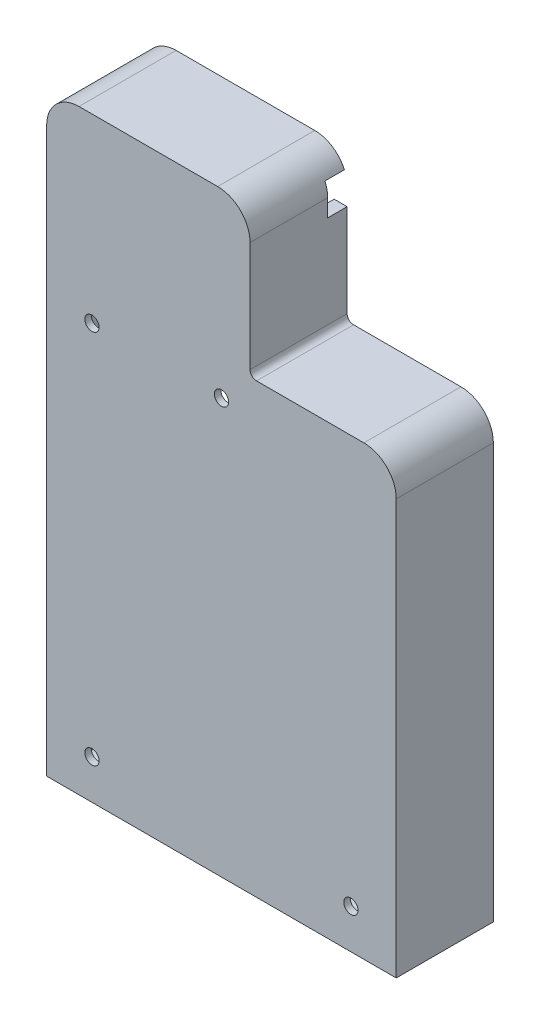
from build123d import *

# Parameters (mm, degrees)
BOSS_EXTRUDE1_DEPTH = 15
BOSS_EXTRUDE2_DEPTH = 15
CUT_EXTRUDE1_DEPTH  = 14
SKETCH8_W           = 6.699223296
SKETCH8_H           = 4.721357371
SKETCH8_W_2         = 8.228893272
CUT_EXTRUDE7_DEPTH  = 3
SKETCH10_R          = 1.1
CUT_EXTRUDE9_DEPTH  = 15


with BuildPart() as part:
    # Sketch3 → Boss-Extrude1 (new body)
    with BuildSketch(Plane.XY.offset(1303.472903018)):
        with BuildLine():
            Line((839.650097305, 1097.589789038), (839.650097371, 1033.49652121))
            Line((839.650097371, 1033.49652121), (785.650097371, 1033.49652121))
            Line((785.650097371, 1033.49652121), (785.650097438, 1120.589789038))
            ThreePointArc((785.650097438, 1120.589789038), (787.114883847, 1124.124637961), (790.64973277, 1125.58942437))
            Line((790.64973277, 1125.58942437), (812.066461973, 1125.58942437))
            ThreePointArc((812.066461973, 1125.58942437), (815.601310896, 1124.124637961), (817.066097305, 1120.589789038))
            Line((817.066097305, 1120.589789038), (817.066097305, 1103.589789038))
            ThreePointArc((817.066097305, 1103.589789038), (817.35931084, 1102.882637905), (818.066461973, 1102.58942437))
            Line((818.066461973, 1102.58942437), (834.650461973, 1102.58942437))
            ThreePointArc((834.650461973, 1102.58942437), (838.185310896, 1101.124637961), (839.650097305, 1097.589789038))
        make_face()
        with BuildLine():
            Line((787.650097371, 1035.49652121), (787.650097371, 1120.589424436))
            ThreePointArc((787.650097371, 1120.589424436), (788.529097371, 1122.710424436), (790.650097371, 1123.589424436))
            Line((790.650097371, 1123.589424436), (812.066097371, 1123.589424436))
            ThreePointArc((812.066097371, 1123.589424436), (814.187097371, 1122.710424436), (815.066097371, 1120.589424436))
            Line((815.066097371, 1120.589424436), (815.066097371, 1103.589424436))
            ThreePointArc((815.066097371, 1103.589424436), (815.945097371, 1101.468424436), (818.066097371, 1100.589424436))
            Line((818.066097371, 1100.589424436), (834.650097371, 1100.589424436))
            ThreePointArc((834.650097371, 1100.589424436), (836.771097371, 1099.710424436), (837.650097371, 1097.589424436))
            Line((837.650097371, 1097.589424436), (837.650097371, 1035.49652121))
            Line((837.650097371, 1035.49652121), (787.650097371, 1035.49652121))
        make_face(mode=Mode.SUBTRACT)
    extrude(amount=BOSS_EXTRUDE1_DEPTH)

    # Sketch6 → Boss-Extrude2 (add)
    with BuildSketch(Plane.XY.offset(1303.472903018)):
        with BuildLine():
            Line((787.650097371, 1035.49652121), (837.650097371, 1035.49652121))
            Line((837.650097371, 1035.49652121), (837.650097371, 1097.589424436))
            ThreePointArc((837.650097371, 1097.589424436), (836.771097371, 1099.710424436), (834.650097371, 1100.589424436))
            Line((834.650097371, 1100.589424436), (818.066097371, 1100.589424436))
            ThreePointArc((818.066097371, 1100.589424436), (815.945097371, 1101.468424436), (815.066097371, 1103.589424436))
            Line((815.066097371, 1103.589424436), (815.066097371, 1120.589424436))
            ThreePointArc((815.066097371, 1120.589424436), (814.187097371, 1122.710424436), (812.066097371, 1123.589424436))
            Line((812.066097371, 1123.589424436), (790.650097371, 1123.589424436))
            ThreePointArc((790.650097371, 1123.589424436), (788.529097371, 1122.710424436), (787.650097371, 1120.589424436))
            Line((787.650097371, 1120.589424436), (787.650097371, 1035.49652121))
        make_face()
    extrude(amount=BOSS_EXTRUDE2_DEPTH)

    # Sketch6<2> → Cut-Extrude1 (cut)
    with BuildSketch(Plane.XY.offset(1303.472903018)):
        with BuildLine():
            Line((787.650097371, 1035.49652121), (837.650097371, 1035.49652121))
            Line((837.650097371, 1035.49652121), (837.650097371, 1097.589424436))
            ThreePointArc((837.650097371, 1097.589424436), (836.771097371, 1099.710424436), (834.650097371, 1100.589424436))
            Line((834.650097371, 1100.589424436), (818.066097371, 1100.589424436))
            ThreePointArc((818.066097371, 1100.589424436), (815.945097371, 1101.468424436), (815.066097371, 1103.589424436))
            Line((815.066097371, 1103.589424436), (815.066097371, 1120.589424436))
            ThreePointArc((815.066097371, 1120.589424436), (814.187097371, 1122.710424436), (812.066097371, 1123.589424436))
            Line((812.066097371, 1123.589424436), (790.650097371, 1123.589424436))
            ThreePointArc((790.650097371, 1123.589424436), (788.529097371, 1122.710424436), (787.650097371, 1120.589424436))
            Line((787.650097371, 1120.589424436), (787.650097371, 1035.49652121))
        make_face()
    extrude(amount=CUT_EXTRUDE1_DEPTH, mode=Mode.SUBTRACT)

    # Sketch8 → Cut-Extrude7 (cut)
    with BuildSketch(Plane.XY.offset(1303.472903018)):
        with Locations((788.177093813, 1120.255926572)):
            Rectangle(SKETCH8_W, SKETCH8_H)
        with Locations((813.958809837, 1120.255926572)):
            Rectangle(SKETCH8_W_2, SKETCH8_H)
    extrude(amount=CUT_EXTRUDE7_DEPTH, mode=Mode.SUBTRACT)

    # Sketch10 → Cut-Extrude9 (cut)
    with BuildSketch(Plane.XY.offset(1303.472903018)):
        with Locations((832.650097371, 1039.589424436)):
            Circle(SKETCH10_R)
        with Locations((792.650097371, 1039.589424436)):
            Circle(SKETCH10_R)
        with Locations((792.650097371, 1097.589424436)):
            Circle(SKETCH10_R)
        with Locations((812.650097371, 1097.589424436)):
            Circle(SKETCH10_R)
    extrude(amount=CUT_EXTRUDE9_DEPTH, mode=Mode.SUBTRACT)


solid = part.part
